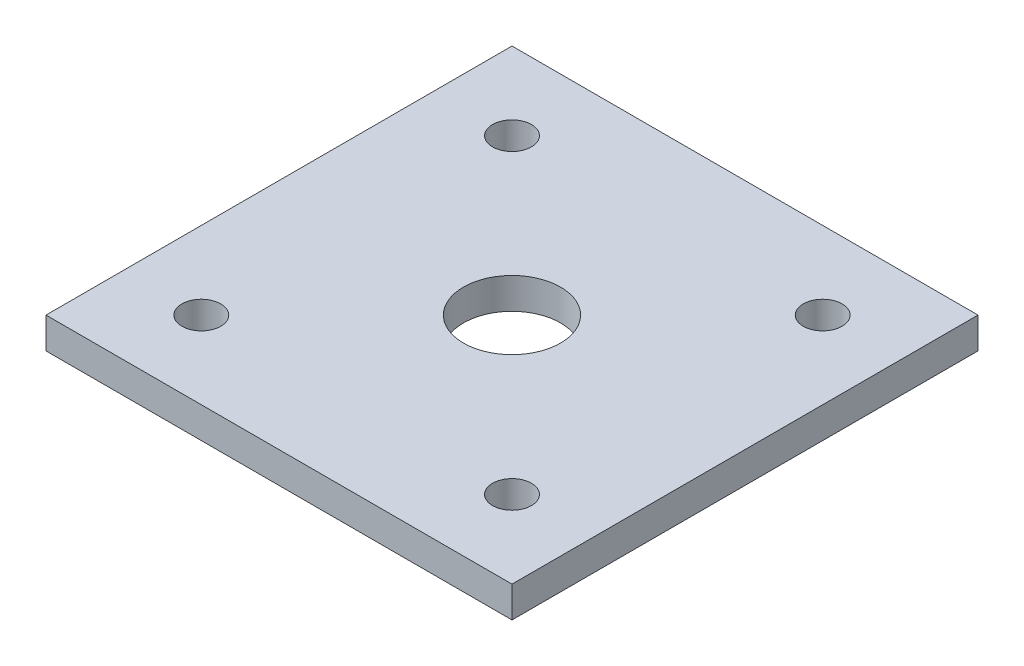
from build123d import *

# Parameters (mm, degrees)
SKETCH1_W               = 120
SKETCH1_H               = 120
BOSS_EXTRUDE2_DEPTH     = 8
SKETCH4_R               = 12.5
CUT_EXTRUDE2_DEPTH      = 86.229103011
SKETCH5_R               = 5
CUT_EXTRUDE3_DEPTH      = 86.229103011
MIRROR2_COPY_1_SKETCH_R = 5
MIRROR2_COPY_1_DEPTH    = 86.229103011


with BuildPart() as part:
    # Sketch1 → Boss-Extrude2 (new body)
    with BuildSketch(Plane(origin=(0, 0, 0), x_dir=(1, 0, 0), z_dir=(0, 1, 0))):
        Rectangle(SKETCH1_W, SKETCH1_H)
    extrude(amount=BOSS_EXTRUDE2_DEPTH)

    # Sketch4 → Cut-Extrude2 (cut, through all)
    with BuildSketch(Plane(origin=(0, 8, 0), x_dir=(1, 0, 0), z_dir=(0, 1, 0))):
        with Locations(Location((0, 0, 0), (0, 0, 270))):
            Circle(SKETCH4_R)
    extrude(amount=-CUT_EXTRUDE2_DEPTH, mode=Mode.SUBTRACT)

    # Sketch5 → Cut-Extrude3 (cut, through all)
    with BuildSketch(Plane(origin=(0, 8, 0), x_dir=(1, 0, 0), z_dir=(0, 1, 0))):
        with Locations(Location((-40, 40, 0), (0, 0, 270))):
            Circle(SKETCH5_R)
    cut_extrude3 = extrude(amount=-CUT_EXTRUDE3_DEPTH, mode=Mode.SUBTRACT)

    # Mirror1: Cut-Extrude3 across plane
    add(cut_extrude3.mirror(Plane(origin=(0, 0, 0), x_dir=(0, 0, 1), z_dir=(1, 0, 0))), mode=Mode.SUBTRACT)

    # Mirror2: Cut-Extrude3 across plane
    add(cut_extrude3.mirror(Plane.XY), mode=Mode.SUBTRACT)

    # Mirror2 copy 1 sketch → Mirror2 copy 1 (cut, through all)
    with BuildSketch(Plane(origin=(0, 8, 0), x_dir=(-1, 0, 0), z_dir=(0, 1, 0))):
        with Locations(Location((-40, 40, 0), (0, 0, 270))):
            Circle(MIRROR2_COPY_1_SKETCH_R)
    extrude(amount=-MIRROR2_COPY_1_DEPTH, mode=Mode.SUBTRACT)


solid = part.part
